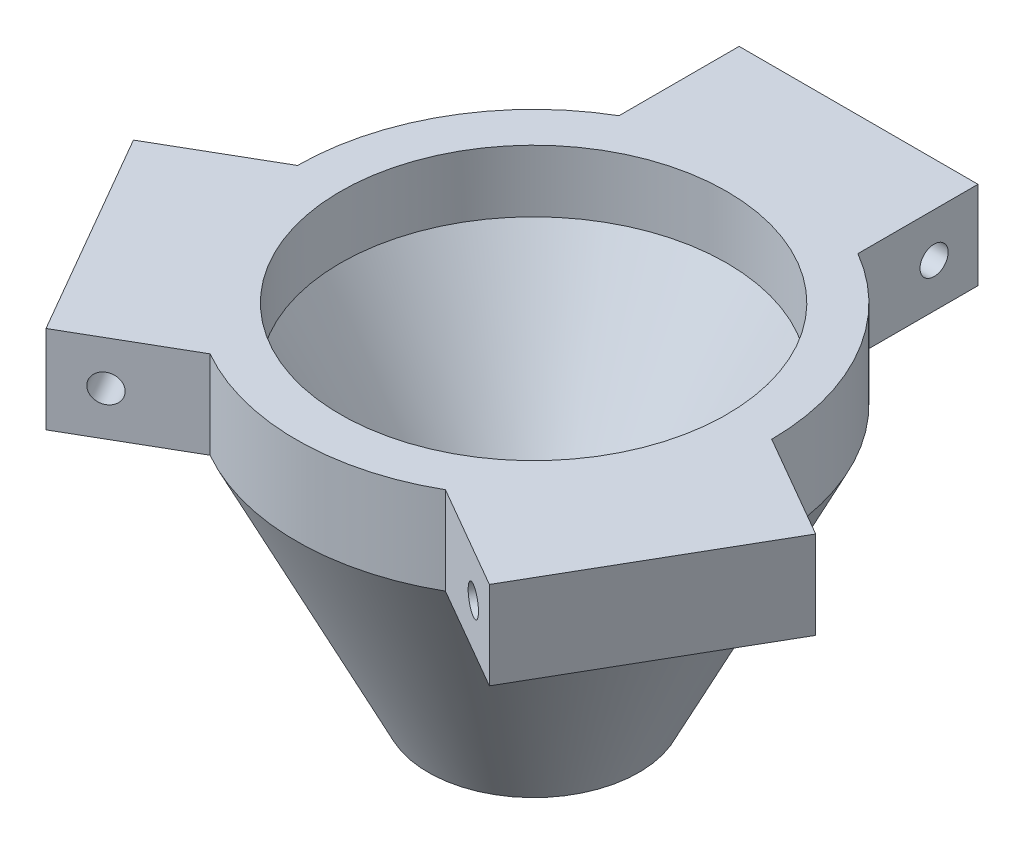
from build123d import *

# Parameters (mm, degrees)
ESQUISSE2_W                  = 27.2
ESQUISSE2_H                  = 14.017263762
BOSS_EXTRU_1_DEPTH           = 10
ESQUISSE3_R                  = 1.6
ENL_V_MAT_EXTRU_1_DEPTH      = 69.128187999
R_P_TITION_CIRCULAIRE1_COUNT = 3


with BuildPart() as part:
    # Esquisse1 → Révolution1 (revolve)
    with BuildSketch(Plane.XY):
        Polygon((-6, 0), (-12, 0), (-27, 30.3), (-27, 40.3), (-22, 40.3), (-22, 33.237189942), (-6, 7.254793936), align=None)
    revolve(axis=Axis((0, 0, 0), (0, 1, 0)))

    # Esquisse2 → Boss.-Extru.1 (add)
    with BuildSketch(Plane(origin=(0, 40.3, 0), x_dir=(1, 0, 0), z_dir=(0, 1, 0))):
        with Locations((0, 29.991368119)):
            Rectangle(ESQUISSE2_W, ESQUISSE2_H)
    boss_extru_1 = extrude(amount=-BOSS_EXTRU_1_DEPTH)

    # Esquisse3 → Enlèv. mat.-Extru.1 (cut, through all)
    with BuildSketch(Plane.ZY.offset(13.6)):
        with Locations((-32, 35.3)):
            Circle(ESQUISSE3_R)
    enl_v_mat_extru_1 = extrude(amount=-ENL_V_MAT_EXTRU_1_DEPTH, mode=Mode.SUBTRACT)

    # Répétition circulaire1: Boss.-Extru.1, Enlèv. mat.-Extru.1 ×3 about axis
    r_p_tition_circulaire1_axis = Axis((0, 30.3, 0), (0, -1, 0))
    add([boss_extru_1.rotate(r_p_tition_circulaire1_axis, i * 360 / R_P_TITION_CIRCULAIRE1_COUNT) for i in range(1, R_P_TITION_CIRCULAIRE1_COUNT)])
    add([enl_v_mat_extru_1.rotate(r_p_tition_circulaire1_axis, i * 360 / R_P_TITION_CIRCULAIRE1_COUNT) for i in range(1, R_P_TITION_CIRCULAIRE1_COUNT)], mode=Mode.SUBTRACT)


solid = part.part
